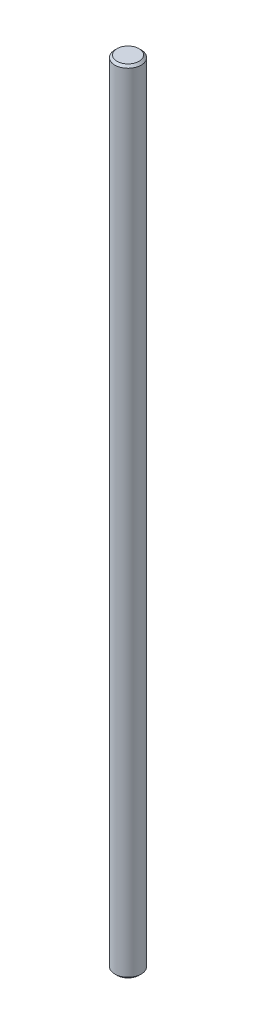
from build123d import *

# Parameters (mm, degrees)
IZIM1_R                     = 3
Y_KSEKLIK_EKSTR_ZYON1_DEPTH = 180
PAH1_SIZE                   = 0.5


with BuildPart() as part:
    # Çizim1 → Yükseklik-Ekstrüzyon1 (new body)
    with BuildSketch(Plane(origin=(0, 0, 0), x_dir=(1, 0, 0), z_dir=(0, 1, 0))):
        with Locations(Location((0, 0, 0), (0, 0, 90))):
            Circle(IZIM1_R)
    extrude(amount=Y_KSEKLIK_EKSTR_ZYON1_DEPTH)

    # Pah1
    pah1_edges = [part.edges().sort_by_distance(p)[0] for p in [
        (0, 0, 3),
        (0, 180, 3),
    ]]
    chamfer(pah1_edges, length=PAH1_SIZE)


solid = part.part
